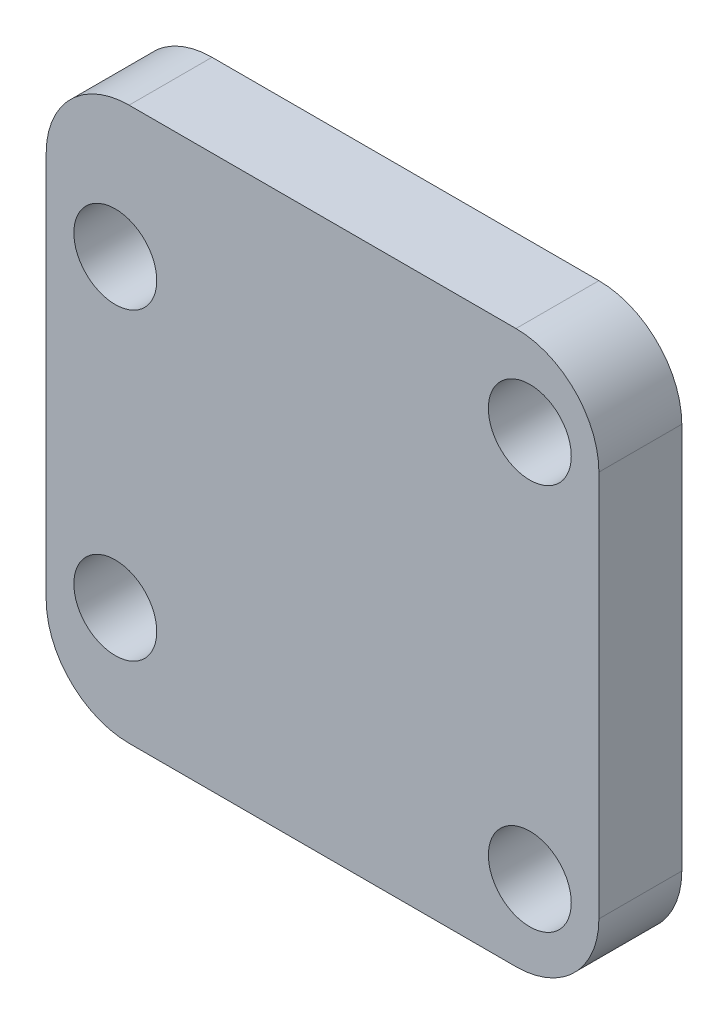
from build123d import *

# Parameters (mm, degrees)
SKETCH_1_W      = 20
SKETCH_1_H      = 20
SKETCH_1_R      = 1.5
EXTRUDE_1_DEPTH = 3
FILLET_1_R      = 3


with BuildPart() as part:
    # 草图1 → 凸台-拉伸1 (new body)
    with BuildSketch(Plane.XY):
        Rectangle(SKETCH_1_W, SKETCH_1_H)
        with Locations((7.5, 7)):
            Circle(SKETCH_1_R, mode=Mode.SUBTRACT)
        with Locations((7.5, -7)):
            Circle(SKETCH_1_R, mode=Mode.SUBTRACT)
        with Locations((-7.5, 5)):
            Circle(SKETCH_1_R, mode=Mode.SUBTRACT)
        with Locations((-7.5, -6)):
            Circle(SKETCH_1_R, mode=Mode.SUBTRACT)
    extrude(amount=EXTRUDE_1_DEPTH)

    # 圆角1
    fillet_1_edges = [part.edges().sort_by_distance(p)[0] for p in [
        (10, -10, 1.5),
        (-10, -10, 1.5),
        (-10, 10, 1.5),
        (10, 10, 1.5),
    ]]
    fillet(fillet_1_edges, radius=FILLET_1_R)


solid = part.part
